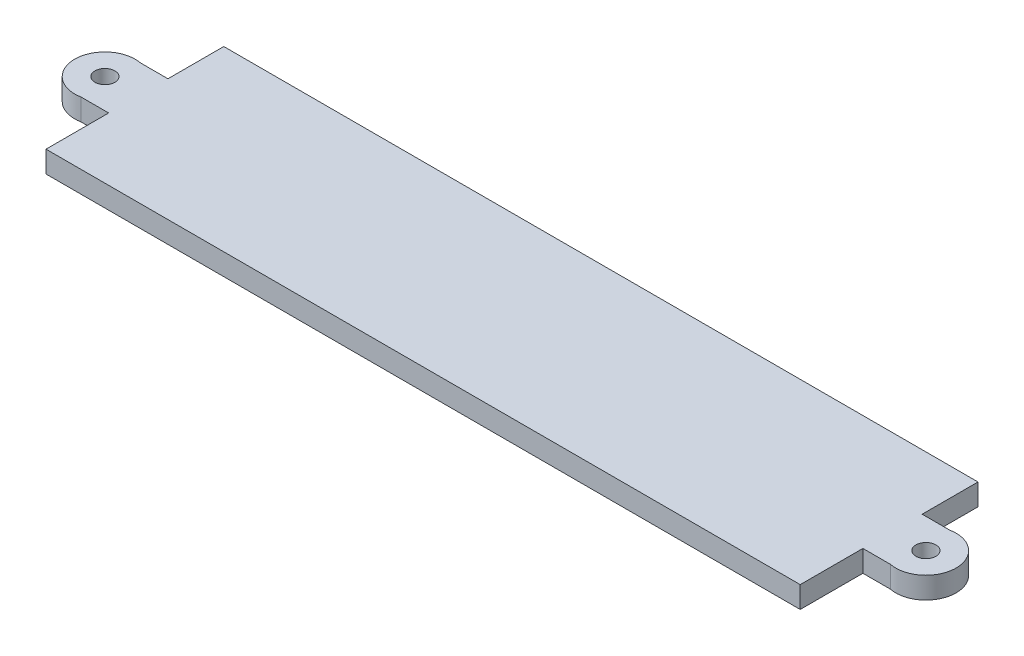
from build123d import *

# Parameters (mm, degrees)
SKETCH1_W           = 88.9
SKETCH1_H           = 41.91
BOSS_EXTRUDE1_DEPTH = 5.08
CUT_EXTRUDE1_REACH  = 93.131
SKETCH2_R           = 2.3495


with BuildPart() as part:
    # Sketch1 → Boss-Extrude1 (new body)
    with BuildSketch(Plane(origin=(0, 0, 0), x_dir=(1, 0, 0), z_dir=(0, 1, 0))):
        with BuildLine():
            ThreePointArc((-77.441755774, -1.121902455), (-85.948469046, -8.106902455), (-77.441755774, -15.091902455))
            Line((-77.441755774, -15.091902455), (-78.827364113, -15.091902455))
            Line((-78.827364113, -15.091902455), (-78.827364113, -1.121902455))
            Line((-78.827364113, -1.121902455), (-77.441755774, -1.121902455))
        make_face()
        with BuildLine():
            Line((-78.827364113, -15.091902455), (-77.441755774, -15.091902455))
            ThreePointArc((-77.441755774, -15.091902455), (-73.323856239, -12.625921878), (-71.70625918, -8.106902455))
            ThreePointArc((-71.70625918, -8.106902455), (-73.323856239, -3.587883032), (-77.441755774, -1.121902455))
            Line((-77.441755774, -1.121902455), (-78.827364113, -1.121902455))
            Line((-78.827364113, -1.121902455), (-78.827364113, -15.091902455))
        make_face()
        with BuildLine():
            Line((-77.441755774, -15.091902455), (-70.953364113, -15.091902455))
            Line((-70.953364113, -15.091902455), (-70.953364113, -1.121902455))
            Line((-70.953364113, -1.121902455), (-77.441755774, -1.121902455))
            ThreePointArc((-77.441755774, -1.121902455), (-73.323856239, -3.587883032), (-71.70625918, -8.106902455))
            ThreePointArc((-71.70625918, -8.106902455), (-73.323856239, -12.625921878), (-77.441755774, -15.091902455))
        make_face()
        with Locations((-26.503364113, -8.911027969)):
            Rectangle(SKETCH1_W, SKETCH1_H)
    boss_extrude1 = extrude(amount=BOSS_EXTRUDE1_DEPTH)

    # Sketch2 → Cut-Extrude1 (cut, up to next)
    with BuildSketch(Plane(origin=(0, 0, 0), x_dir=(-1, 0, 0), z_dir=(0, -1, 0)), mode=Mode.PRIVATE) as cut_extrude1_sk1:
        with Locations(Location((78.827364113, -8.106902455, 0), (0, 0, 90))):
            Circle(SKETCH2_R)
    cut_extrude1_tool1 = extrude(cut_extrude1_sk1.sketch, amount=-CUT_EXTRUDE1_REACH, mode=Mode.PRIVATE) & part.part
    cut_extrude1 = cut_extrude1_tool1.solids().sort_by_distance((-78.827364, 0, 8.106902))[0]
    add(cut_extrude1, mode=Mode.SUBTRACT)

    # Mirror2: Boss-Extrude1, Cut-Extrude1 across plane
    add(boss_extrude1.mirror(Plane(origin=(17.946635887, 5.08, 0), x_dir=(0, 0, 1), z_dir=(-1, 0, 0))))
    add(cut_extrude1.mirror(Plane(origin=(17.946635887, 5.08, 0), x_dir=(0, 0, 1), z_dir=(-1, 0, 0))), mode=Mode.SUBTRACT)


solid = part.part
